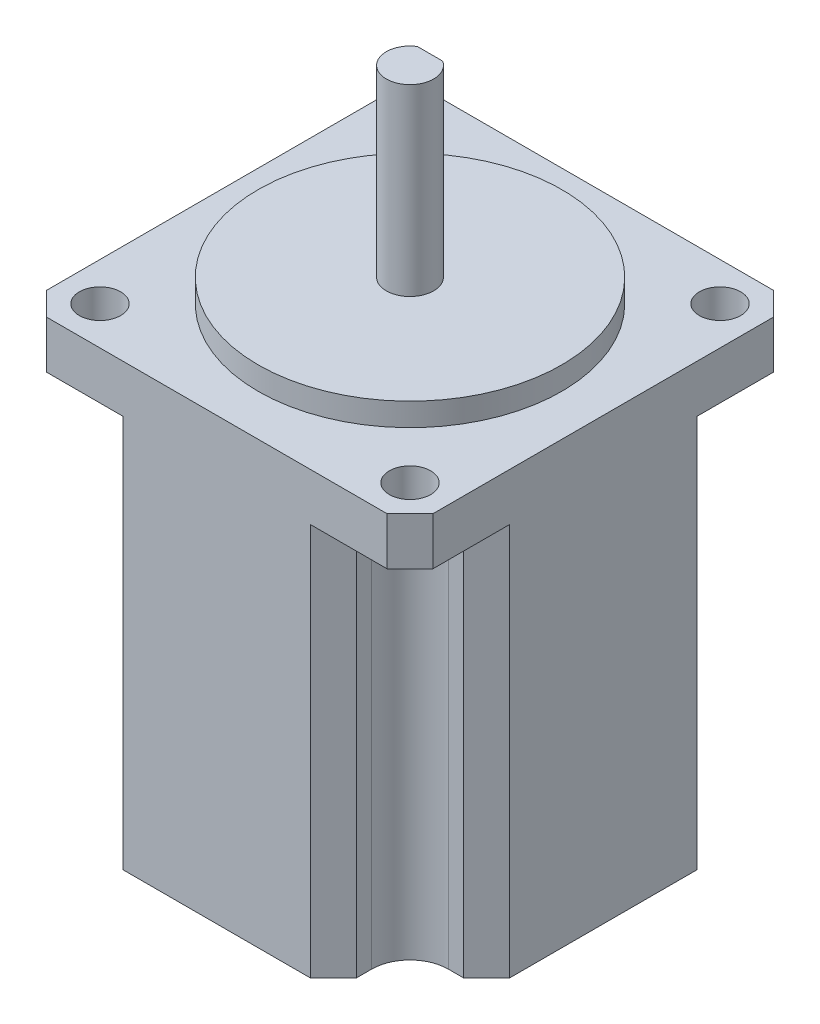
from build123d import *

# Parameters (mm, degrees)
CROQUIS1_W                                 = 42.14
CROQUIS1_H                                 = 42.14
SALIENTE_EXTRUIR1_DEPTH                    = 48
CORTAR_EXTRUIR1_DEPTH                      = 53.151029
SIMETR_A3_AT_THE_SECOND_PLANE_COPY_1_DEPTH = 53.151029
CHAFL_N1_SIZE                              = 2.5
CROQUIS3_R                                 = 2.25
CORTAR_EXTRUIR2_DEPTH                      = 53.151029
SIMETR_A4_AT_THE_SECOND_PLANE_COPY_1_SKE_R = 2.25
SIMETR_A4_AT_THE_SECOND_PLANE_COPY_1_DEPTH = 53.151029
CROQUIS4_R                                 = 16.55
SALIENTE_EXTRUIR2_DEPTH                    = 2.5
CROQUIS6_R                                 = 2.58
SALIENTE_EXTRUIR4_DEPTH                    = 2
SALIENTE_EXTRUIR5_DEPTH                    = 18
SALIENTE_EXTRUIR3_DEPTH                    = 20
CHAFL_N2_SIZE                              = 2.5


with BuildPart() as part:
    # Croquis1 → Saliente-Extruir1 (new body)
    with BuildSketch(Plane(origin=(0, 0, 0), x_dir=(1, 0, 0), z_dir=(0, 1, 0))):
        Rectangle(CROQUIS1_W, CROQUIS1_H)
    extrude(amount=SALIENTE_EXTRUIR1_DEPTH)

    # Croquis2 → Cortar-Extruir1 (cut, through all)
    with BuildSketch(Plane(origin=(0, 42.8, 0), x_dir=(1, 0, 0), z_dir=(0, 1, 0))):
        with BuildLine():
            Line((-21.07, 12.72), (-16.895, 12.72))
            ThreePointArc((-16.895, 12.72), (-13.942829, 13.942829), (-12.72, 16.895))
            Line((-12.72, 16.895), (-12.72, 21.07))
            Line((-12.72, 21.07), (-21.07, 21.07))
            Line((-21.07, 21.07), (-21.07, 12.72))
        make_face()
    cortar_extruir1 = extrude(amount=-CORTAR_EXTRUIR1_DEPTH, mode=Mode.SUBTRACT)

    # Simetría3: Cortar-Extruir1 across plane
    add(cortar_extruir1.mirror(Plane(origin=(0, 0, 0), x_dir=(0, 0, 1), z_dir=(1, 0, 0))), mode=Mode.SUBTRACT)

    # Simetría3 at the second plane: Cortar-Extruir1 across plane
    add(cortar_extruir1.mirror(Plane.XY), mode=Mode.SUBTRACT)

    # Simetría3 at the second plane copy 1 ske → Simetría3 at the second plane copy 1 (cut, through all)
    with BuildSketch(Plane(origin=(0, 42.8, 0), x_dir=(-1, 0, 0), z_dir=(0, 1, 0))):
        with BuildLine():
            Line((-21.07, 12.72), (-16.895, 12.72))
            ThreePointArc((-16.895, 12.72), (-13.942829, 13.942829), (-12.72, 16.895))
            Line((-12.72, 16.895), (-12.72, 21.07))
            Line((-12.72, 21.07), (-21.07, 21.07))
            Line((-21.07, 21.07), (-21.07, 12.72))
        make_face()
    extrude(amount=-SIMETR_A3_AT_THE_SECOND_PLANE_COPY_1_DEPTH, mode=Mode.SUBTRACT)

    # Chaflán1
    chafl_n1_edges = [part.edges().sort_by_distance(p)[0] for p in [
        (-21.07, 21.4, -12.72),
        (-12.72, 21.4, -21.07),
        (-21.07, 21.4, 12.72),
        (-12.72, 21.4, 21.07),
        (21.07, 21.4, -12.72),
        (12.72, 21.4, -21.07),
        (21.07, 21.4, 12.72),
        (12.72, 21.4, 21.07),
    ]]
    chamfer(chafl_n1_edges, length=CHAFL_N1_SIZE)

    # Croquis3 → Cortar-Extruir2 (cut, through all)
    with BuildSketch(Plane.XZ.offset(-42.8)):
        with Locations(Location((16.895, -16.895, 0), (0, 0, 270))):
            Circle(CROQUIS3_R)
    cortar_extruir2 = extrude(amount=-CORTAR_EXTRUIR2_DEPTH, mode=Mode.SUBTRACT)

    # Simetría4: Cortar-Extruir2 across plane
    add(cortar_extruir2.mirror(Plane(origin=(0, 0, 0), x_dir=(0, 0, 1), z_dir=(1, 0, 0))), mode=Mode.SUBTRACT)

    # Simetría4 at the second plane: Cortar-Extruir2 across plane
    add(cortar_extruir2.mirror(Plane.XY), mode=Mode.SUBTRACT)

    # Simetría4 at the second plane copy 1 ske → Simetría4 at the second plane copy 1 (cut, through all)
    with BuildSketch(Plane(origin=(0, 42.8, 0), x_dir=(-1, 0, 0), z_dir=(0, -1, 0))):
        with Locations(Location((16.895, -16.895, 0), (0, 0, 270))):
            Circle(SIMETR_A4_AT_THE_SECOND_PLANE_COPY_1_SKE_R)
    extrude(amount=-SIMETR_A4_AT_THE_SECOND_PLANE_COPY_1_DEPTH, mode=Mode.SUBTRACT)

    # Croquis4 → Saliente-Extruir2 (add)
    with BuildSketch(Plane(origin=(0, 48, 0), x_dir=(1, 0, 0), z_dir=(0, 1, 0))):
        with Locations(Location((0, 0, 0), (0, 0, 270))):
            Circle(CROQUIS4_R)
    extrude(amount=SALIENTE_EXTRUIR2_DEPTH)

    # Croquis6 → Saliente-Extruir4 (add)
    with BuildSketch(Plane(origin=(0, 50.5, 0), x_dir=(1, 0, 0), z_dir=(0, 1, 0))):
        with Locations(Location((0, 0, 0), (0, 0, 270))):
            Circle(CROQUIS6_R)
    extrude(amount=SALIENTE_EXTRUIR4_DEPTH)

    # Croquis7 → Saliente-Extruir5 (add)
    with BuildSketch(Plane(origin=(0, 52.5, 0), x_dir=(1, 0, 0), z_dir=(0, 1, 0))):
        with BuildLine():
            Line((-1.379855, 2.18), (1.379855, 2.18))
            ThreePointArc((1.379855, 2.18), (0, -2.58), (-1.379855, 2.18))
        make_face()
    extrude(amount=SALIENTE_EXTRUIR5_DEPTH)

    # Croquis5 → Saliente-Extruir3 (add)
    with BuildSketch(Plane(origin=(0, 50.5, 0), x_dir=(1, 0, 0), z_dir=(0, 1, 0))):
        with BuildLine():
            Line((-1.379855, 2.18), (1.379855, 2.18))
            ThreePointArc((1.379855, 2.18), (0, -2.58), (-1.379855, 2.18))
        make_face()
    extrude(amount=SALIENTE_EXTRUIR3_DEPTH)

    # Chaflán2
    chafl_n2_edges = [part.edges().sort_by_distance(p)[0] for p in [
        (-21.07, 45.4, -21.07),
        (21.07, 45.4, -21.07),
        (21.07, 45.4, 21.07),
        (-21.07, 45.4, 21.07),
    ]]
    chamfer(chafl_n2_edges, length=CHAFL_N2_SIZE)


solid = part.part
